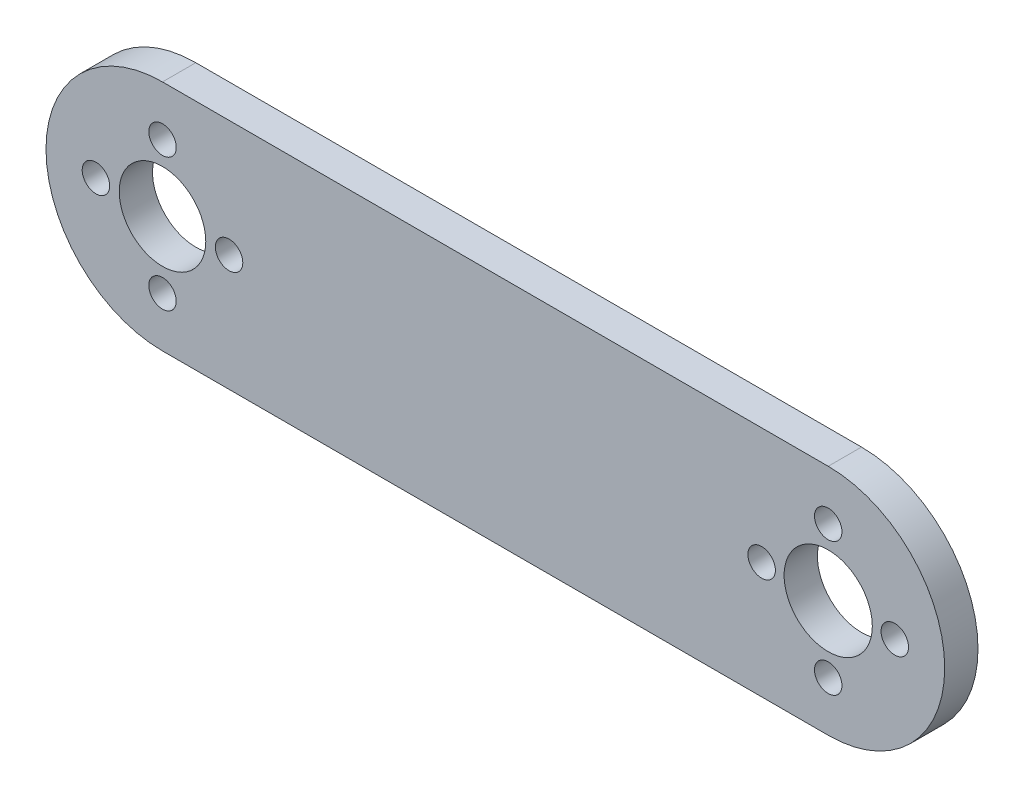
from build123d import *

# Parameters (mm, degrees)
EXTRUDE_1_DEPTH = 4


with BuildPart() as part:
    # 草图1 → 凸台-拉伸1 (new body)
    with BuildSketch(Plane.XY):
        with BuildLine():
            Line((0, 9.65), (0, 14))
            ThreePointArc((0, 14), (-14, 0), (0, -14))
            Line((0, -14), (0, -9.65))
            ThreePointArc((0, -9.65), (-1.225409689, -9.104930357), (-1.641202867, -7.82984375))
            ThreePointArc((-1.641202867, -7.82984375), (-5.656854249, -5.656854249), (-7.82984375, -1.641202867))
            ThreePointArc((-7.82984375, -1.641202867), (-9.65, 0), (-7.82984375, 1.641202867))
            ThreePointArc((-7.82984375, 1.641202867), (-5.656854249, 5.656854249), (-1.641202867, 7.82984375))
            ThreePointArc((-1.641202867, 7.82984375), (-1.225409689, 9.104930357), (0, 9.65))
        make_face()
        with BuildLine():
            ThreePointArc((0, 6.35), (-1.104930357, 6.774590311), (-1.641202867, 7.82984375))
            ThreePointArc((-1.641202867, 7.82984375), (-5.656854249, 5.656854249), (-7.82984375, 1.641202867))
            ThreePointArc((-7.82984375, 1.641202867), (-6.774590311, 1.104930357), (-6.35, 0))
            ThreePointArc((-6.35, 0), (-6.774590311, -1.104930357), (-7.82984375, -1.641202867))
            ThreePointArc((-7.82984375, -1.641202867), (-5.656854249, -5.656854249), (-1.641202867, -7.82984375))
            ThreePointArc((-1.641202867, -7.82984375), (-1.104930357, -6.774590311), (0, -6.35))
            Line((0, -6.35), (0, -5.2))
            ThreePointArc((0, -5.2), (-5.2, 0), (0, 5.2))
            Line((0, 5.2), (0, 6.35))
        make_face()
        with BuildLine():
            ThreePointArc((1.641202867, 7.82984375), (1.104930357, 6.774590311), (0, 6.35))
            Line((0, 6.35), (0, 5.2))
            ThreePointArc((0, 5.2), (3.676955262, 3.676955262), (5.2, 0))
            ThreePointArc((5.2, 0), (3.676955262, -3.676955262), (0, -5.2))
            Line((0, -5.2), (0, -6.35))
            ThreePointArc((0, -6.35), (1.104930357, -6.774590311), (1.641202867, -7.82984375))
            ThreePointArc((1.641202867, -7.82984375), (5.656854249, -5.656854249), (7.82984375, -1.641202867))
            ThreePointArc((7.82984375, -1.641202867), (6.35, 0), (7.82984375, 1.641202867))
            ThreePointArc((7.82984375, 1.641202867), (5.656854249, 5.656854249), (1.641202867, 7.82984375))
        make_face()
        with BuildLine():
            ThreePointArc((14, 0), (9.899494937, 9.899494937), (0, 14))
            Line((0, 14), (0, 9.65))
            ThreePointArc((0, 9.65), (1.166726189, 9.166726189), (1.65, 8))
            ThreePointArc((1.65, 8), (1.647799249, 7.914808247), (1.641202867, 7.82984375))
            ThreePointArc((1.641202867, 7.82984375), (5.656854249, 5.656854249), (7.82984375, 1.641202867))
            ThreePointArc((7.82984375, 1.641202867), (9.104930357, 1.225409689), (9.65, 0))
            ThreePointArc((9.65, 0), (9.104930357, -1.225409689), (7.82984375, -1.641202867))
            ThreePointArc((7.82984375, -1.641202867), (5.656854249, -5.656854249), (1.641202867, -7.82984375))
            ThreePointArc((1.641202867, -7.82984375), (1.647799249, -7.914808247), (1.65, -8))
            ThreePointArc((1.65, -8), (1.166726189, -9.166726189), (0, -9.65))
            Line((0, -9.65), (0, -14))
            ThreePointArc((0, -14), (9.899494937, -9.899494937), (14, 0))
        make_face()
        with BuildLine():
            ThreePointArc((94, 0), (89.899494937, 9.899494937), (80, 14))
            Line((80, 14), (80, 9.65))
            ThreePointArc((80, 9.65), (81.166726189, 9.166726189), (81.65, 8))
            ThreePointArc((81.65, 8), (81.647799249, 7.914808247), (81.641202867, 7.82984375))
            ThreePointArc((81.641202867, 7.82984375), (85.656854249, 5.656854249), (87.82984375, 1.641202867))
            ThreePointArc((87.82984375, 1.641202867), (89.104930357, 1.225409689), (89.65, 0))
            ThreePointArc((89.65, 0), (89.104930357, -1.225409689), (87.82984375, -1.641202867))
            ThreePointArc((87.82984375, -1.641202867), (85.656854249, -5.656854249), (81.641202867, -7.82984375))
            ThreePointArc((81.641202867, -7.82984375), (81.647799249, -7.914808247), (81.65, -8))
            ThreePointArc((81.65, -8), (81.166726189, -9.166726189), (80, -9.65))
            Line((80, -9.65), (80, -14))
            ThreePointArc((80, -14), (89.899494937, -9.899494937), (94, 0))
        make_face()
        with BuildLine():
            Line((80, 9.65), (80, 14))
            ThreePointArc((80, 14), (66, 0), (80, -14))
            Line((80, -14), (80, -9.65))
            ThreePointArc((80, -9.65), (78.774590311, -9.104930357), (78.358797133, -7.82984375))
            ThreePointArc((78.358797133, -7.82984375), (74.343145751, -5.656854249), (72.17015625, -1.641202867))
            ThreePointArc((72.17015625, -1.641202867), (70.35, 0), (72.17015625, 1.641202867))
            ThreePointArc((72.17015625, 1.641202867), (74.343145751, 5.656854249), (78.358797133, 7.82984375))
            ThreePointArc((78.358797133, 7.82984375), (78.774590311, 9.104930357), (80, 9.65))
        make_face()
        with BuildLine():
            ThreePointArc((80, 6.35), (78.895069643, 6.774590311), (78.358797133, 7.82984375))
            ThreePointArc((78.358797133, 7.82984375), (74.343145751, 5.656854249), (72.17015625, 1.641202867))
            ThreePointArc((72.17015625, 1.641202867), (73.225409689, 1.104930357), (73.65, 0))
            ThreePointArc((73.65, 0), (73.225409689, -1.104930357), (72.17015625, -1.641202867))
            ThreePointArc((72.17015625, -1.641202867), (74.343145751, -5.656854249), (78.358797133, -7.82984375))
            ThreePointArc((78.358797133, -7.82984375), (78.895069643, -6.774590311), (80, -6.35))
            Line((80, -6.35), (80, -5.3))
            ThreePointArc((80, -5.3), (74.7, 0), (80, 5.3))
            Line((80, 5.3), (80, 6.35))
        make_face()
        with BuildLine():
            ThreePointArc((81.641202867, 7.82984375), (81.104930357, 6.774590311), (80, 6.35))
            Line((80, 6.35), (80, 5.3))
            ThreePointArc((80, 5.3), (83.74766594, 3.74766594), (85.3, 0))
            ThreePointArc((85.3, 0), (83.74766594, -3.74766594), (80, -5.3))
            Line((80, -5.3), (80, -6.35))
            ThreePointArc((80, -6.35), (81.104930357, -6.774590311), (81.641202867, -7.82984375))
            ThreePointArc((81.641202867, -7.82984375), (85.656854249, -5.656854249), (87.82984375, -1.641202867))
            ThreePointArc((87.82984375, -1.641202867), (86.35, 0), (87.82984375, 1.641202867))
            ThreePointArc((87.82984375, 1.641202867), (85.656854249, 5.656854249), (81.641202867, 7.82984375))
        make_face()
        with BuildLine():
            Line((80, 14), (0, 14))
            ThreePointArc((0, 14), (9.899494937, 9.899494937), (14, 0))
            ThreePointArc((14, 0), (9.899494937, -9.899494937), (0, -14))
            Line((0, -14), (80, -14))
            ThreePointArc((80, -14), (66, 0), (80, 14))
        make_face()
    extrude(amount=EXTRUDE_1_DEPTH)


solid = part.part
